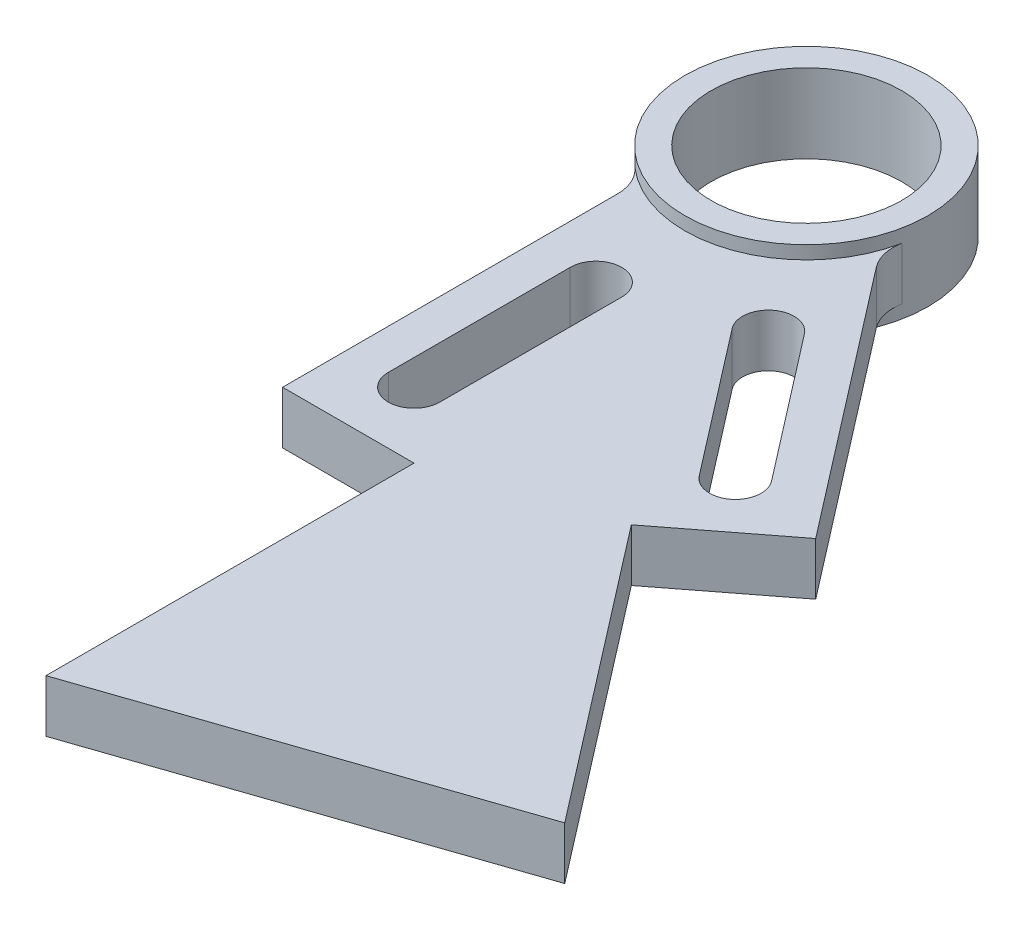
from build123d import *

# Parameters (mm, degrees)
SKETCH1_R             = 14.6812
SKETCH1_R_2           = 11.5062
BEARING_EXTRUDE_DEPTH = 4.7625
BOSS_EXTRUDE2_DEPTH   = 3.175
FILLET1_R             = 5.08


with BuildPart() as part:
    # Sketch1 → Bearing extrude (new, symmetric)
    with BuildSketch(Plane(origin=(0, 0, 0), x_dir=(1, 0, 0), z_dir=(0, 1, 0))):
        with Locations(Location((0, 0, 0), (0, 0, 90))):
            Circle(SKETCH1_R)
        with Locations(Location((0, 0, 0), (0, 0, 90))):
            Circle(SKETCH1_R_2, mode=Mode.SUBTRACT)
    extrude(amount=BEARING_EXTRUDE_DEPTH, both=True)

    # Sketch1<5> → Boss-Extrude2 (add, symmetric)
    with BuildSketch(Plane(origin=(0, 0, 0), x_dir=(1, 0, 0), z_dir=(0, 1, 0))):
        with BuildLine():
            Line((-7.9375, -12.350454534), (-7.9375, -55.3212))
            Line((-7.9375, -55.3212), (7.9375, -55.3212))
            Line((7.9375, -55.3212), (7.9375, -99.7712))
            Line((7.9375, -99.7712), (54.658455113, -83.843601666))
            Line((54.658455113, -83.843601666), (27.50713628, -48.649733087))
            Line((27.50713628, -48.649733087), (33.791755669, -43.801283295))
            Line((33.791755669, -43.801283295), (40.076375058, -38.952833503))
            Line((40.076375058, -38.952833503), (13.828626786, -4.930184039))
            ThreePointArc((13.828626786, -4.930184039), (4.737240469, -13.895905375), (-7.9375, -12.350454534))
        make_face()
        with BuildLine():
            ThreePointArc((3.1115, -47.3837), (0, -50.4952), (-3.1115, -47.3837))
            Line((-3.1115, -47.3837), (-3.1115, -25.4127))
            ThreePointArc((-3.1115, -25.4127), (0, -22.3012), (3.1115, -25.4127))
            Line((3.1115, -25.4127), (3.1115, -47.3837))
        make_face(mode=Mode.SUBTRACT)
        with BuildLine():
            ThreePointArc((31.406876677, -35.616071587), (32.029235213, -37.914749808), (30.843898195, -39.980234706))
            ThreePointArc((30.843898195, -39.980234706), (28.545219974, -40.602593241), (26.479735076, -39.417256224))
            Line((26.479735076, -39.417256224), (13.059226053, -22.021429755))
            ThreePointArc((13.059226053, -22.021429755), (13.622204535, -17.657266636), (17.986367654, -18.220245118))
            Line((17.986367654, -18.220245118), (31.406876677, -35.616071587))
        make_face(mode=Mode.SUBTRACT)
    extrude(amount=BOSS_EXTRUDE2_DEPTH, both=True)

    # Fillet1
    fillet1_edges = [part.edges().sort_by_distance(p)[0] for p in [
        (13.828626786, 0, 4.930184039),
        (-7.9375, 0, 12.350454534),
    ]]
    fillet(fillet1_edges, radius=FILLET1_R)


solid = part.part
